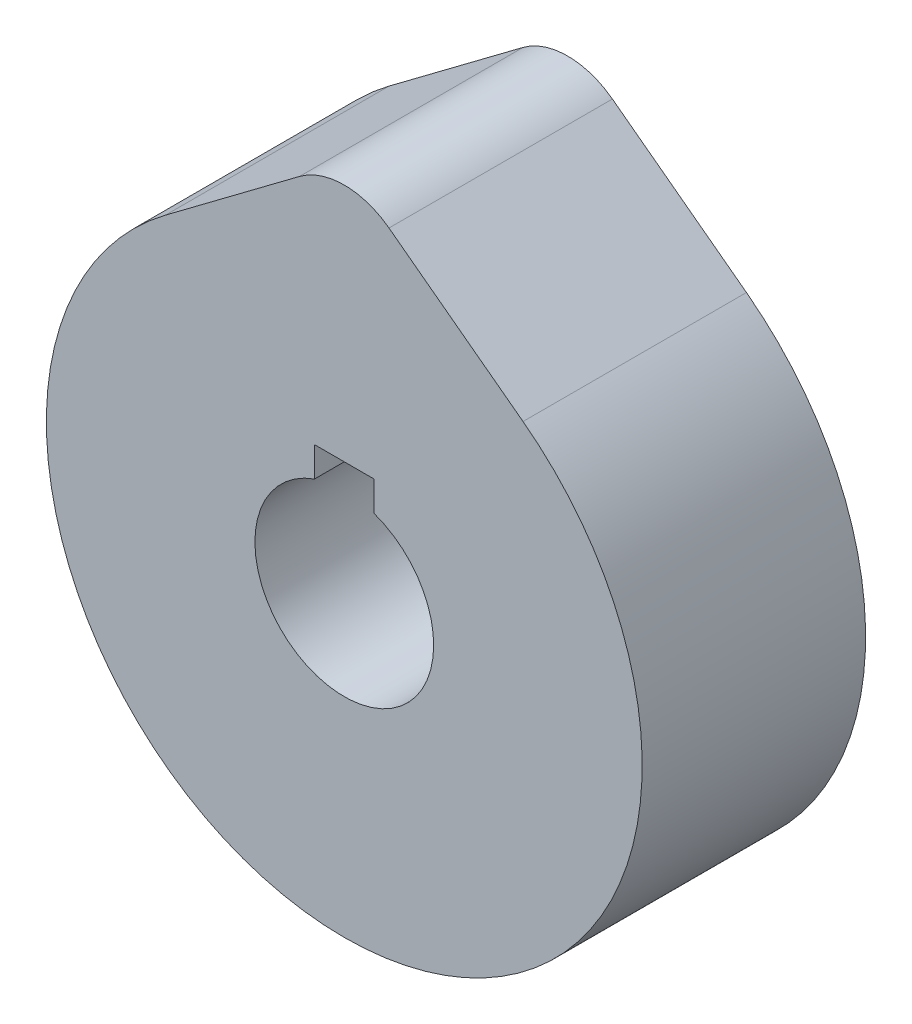
from build123d import *

# Parameters (mm, degrees)
BOSS_EXTRUDE1_DEPTH = 15


with BuildPart() as part:
    # Sketch1 → Boss-Extrude1 (new body)
    with BuildSketch(Plane.XY):
        with BuildLine():
            Line((-3, 22.75), (-12, 16))
            ThreePointArc((-12, 16), (0, -20), (12, 16))
            Line((12, 16), (3, 22.75))
            ThreePointArc((3, 22.75), (0, 23.75), (-3, 22.75))
        make_face()
        with BuildLine():
            Line((2, 7.656854249), (-2, 7.656854249))
            Line((-2, 7.656854249), (-2, 5.656854249))
            ThreePointArc((-2, 5.656854249), (0, -6), (2, 5.656854249))
            Line((2, 5.656854249), (2, 7.656854249))
        make_face(mode=Mode.SUBTRACT)
    extrude(amount=BOSS_EXTRUDE1_DEPTH)


solid = part.part
